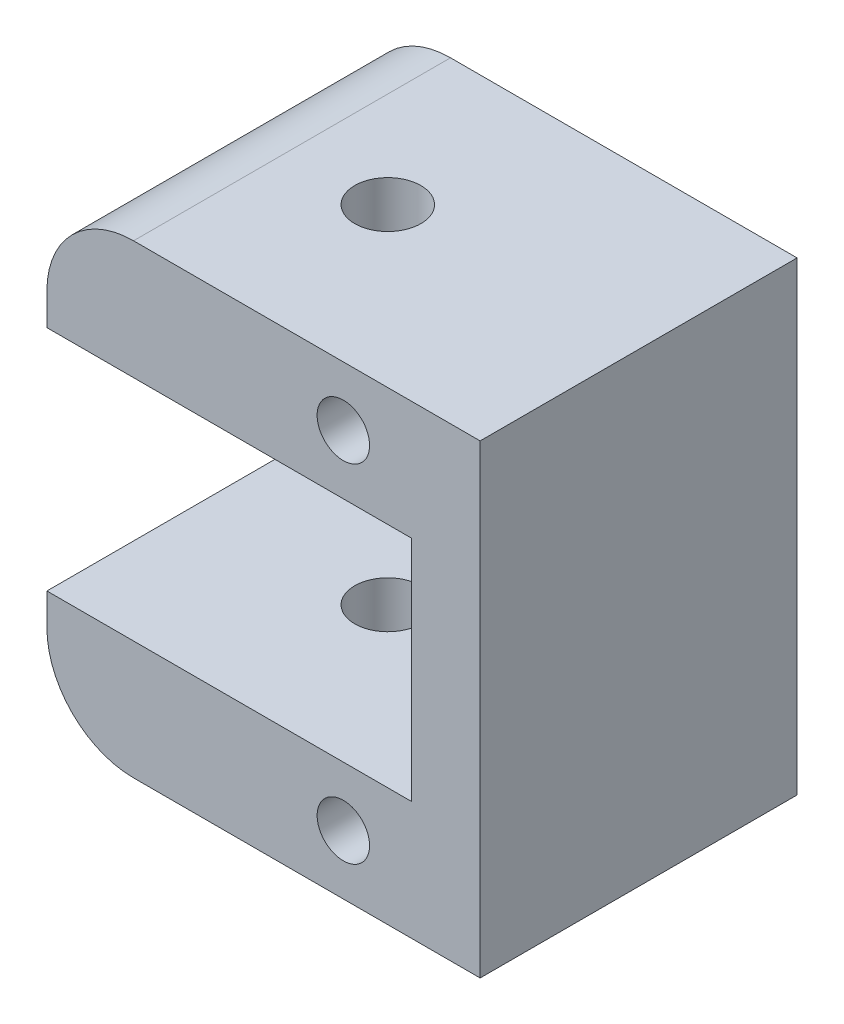
from build123d import *

# Parameters (mm, degrees)
BOSS_EXTRUDE2_DEPTH     = 13.9
CUT_EXTRUDE1_DEPTH      = 21.451161336
CUT_EXTRUDE1_DEPTH_BACK = 21.451161336
SKETCH2_R               = 1.15
SKETCH3_R               = 1.45
CUT_EXTRUDE2_DEPTH      = 28.025358462
FILLET1_R               = 3.8


with BuildPart() as part:
    # Sketch1 → Boss-Extrude2 (new body)
    with BuildSketch(Plane.XY):
        Polygon((-8, 10.2), (-8, 5), (8, 5), (8, -5), (-8, -5), (-8, -10.2), (11, -10.2), (11, 10.2), align=None)
    extrude(amount=-BOSS_EXTRUDE2_DEPTH)

    # Sketch2 → Cut-Extrude1 (cut, two sides: drawn at the far end of the back side and taken through both)
    with BuildSketch(Plane.XY.offset(-CUT_EXTRUDE1_DEPTH_BACK)):
        with Locations((5, 7.6)):
            Circle(SKETCH2_R)
        with Locations((5, -7.6)):
            Circle(SKETCH2_R)
    extrude(amount=CUT_EXTRUDE1_DEPTH + CUT_EXTRUDE1_DEPTH_BACK, mode=Mode.SUBTRACT)

    # Sketch3 → Cut-Extrude2 (cut, through all)
    with BuildSketch(Plane(origin=(0, 10.2, 0), x_dir=(1, 0, 0), z_dir=(0, 1, 0))):
        with Locations(Location((0, 6.95, 0), (0, 0, 180))):
            Circle(SKETCH3_R)
    extrude(amount=-CUT_EXTRUDE2_DEPTH, mode=Mode.SUBTRACT)

    # Fillet1
    fillet1_edges = [part.edges().sort_by_distance(p)[0] for p in [
        (-8, -10.2, -6.95),
        (-8, 10.2, -6.95),
    ]]
    fillet(fillet1_edges, radius=FILLET1_R)


solid = part.part
